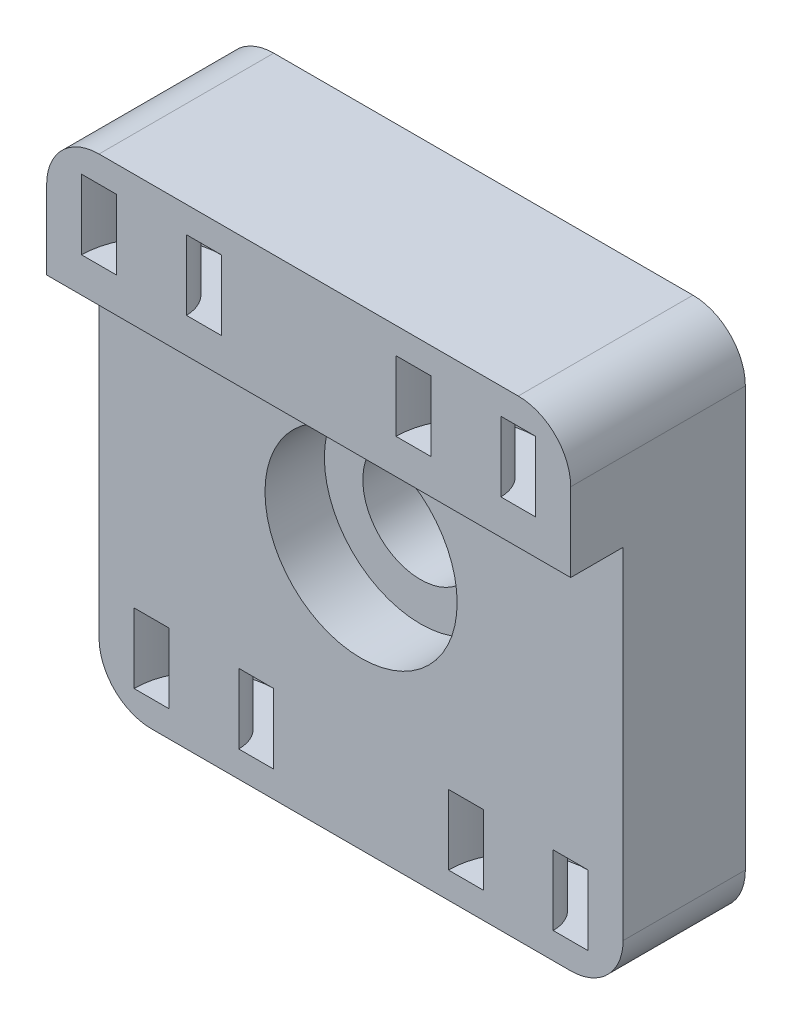
from build123d import *

# Parameters (mm, degrees)
BASE_SKETCH_W           = 30
BASE_SKETCH_H           = 30
BASE_DEPTH              = 7
HIGHER_ADAPTER_SKETCH_W = 30
HIGHER_ADAPTER_SKETCH_H = 7.5
HIGHER_ADAPTER_DEPTH    = 3
MOUNT_SCREW_D           = 6.6
MOUNT_SCREW_CBORE_D     = 11
MOUNT_SCREW_CBORE_DEPTH = 3.4
BOTTOM_TIES_SKETCH_R    = 4
BOTTOM_TIES_SKETCH_R_2  = 2
BOTTOM_TIES_DEPTH       = 4
TOP_TIES_SKETCH_R       = 4
TOP_TIES_SKETCH_R_2     = 2
TOP_TIES_DEPTH          = 4
ROUNDING_R              = 3


with BuildPart() as part:
    # Base sketch → Base (new body)
    with BuildSketch(Plane.XY):
        Rectangle(BASE_SKETCH_W, BASE_SKETCH_H)
    extrude(amount=BASE_DEPTH)

    # Higher adapter sketch → Higher adapter (add)
    with BuildSketch(Plane.XY.offset(7)):
        with Locations((0, 11.25)):
            Rectangle(HIGHER_ADAPTER_SKETCH_W, HIGHER_ADAPTER_SKETCH_H)
    extrude(amount=HIGHER_ADAPTER_DEPTH)

    # Mount screw (through all)
    with Locations(Plane.XY.offset(7)):
        with Locations((0, 0)):
            CounterBoreHole(MOUNT_SCREW_D / 2, MOUNT_SCREW_CBORE_D / 2, MOUNT_SCREW_CBORE_DEPTH)

    # Bottom ties sketch → Bottom ties (cut)
    # profile 1 of 2: a face of its own
    with BuildSketch(Plane.XZ.offset(13.5)):
        with Locations((-9, 7)):
            Circle(BOTTOM_TIES_SKETCH_R)
        with Locations((-9, 7)):
            Circle(BOTTOM_TIES_SKETCH_R_2, mode=Mode.SUBTRACT)
    # profile 2 of 2: a face of its own
    with BuildSketch(Plane.XZ.offset(13.5)):
        with Locations((9, 7)):
            Circle(BOTTOM_TIES_SKETCH_R)
        with Locations((9, 7)):
            Circle(BOTTOM_TIES_SKETCH_R_2, mode=Mode.SUBTRACT)
    extrude(amount=-BOTTOM_TIES_DEPTH, mode=Mode.SUBTRACT)

    # Top ties sketch → Top ties (cut)
    # profile 1 of 2: a face of its own
    with BuildSketch(Plane(origin=(0, 13.5, 0), x_dir=(1, 0, 0), z_dir=(0, 1, 0))):
        with Locations((-9, -10)):
            Circle(TOP_TIES_SKETCH_R)
        with Locations((-9, -10)):
            Circle(TOP_TIES_SKETCH_R_2, mode=Mode.SUBTRACT)
    # profile 2 of 2: a face of its own
    with BuildSketch(Plane(origin=(0, 13.5, 0), x_dir=(1, 0, 0), z_dir=(0, 1, 0))):
        with Locations((9, -10)):
            Circle(TOP_TIES_SKETCH_R)
        with Locations((9, -10)):
            Circle(TOP_TIES_SKETCH_R_2, mode=Mode.SUBTRACT)
    extrude(amount=-TOP_TIES_DEPTH, mode=Mode.SUBTRACT)

    # Rounding
    rounding_edges = [part.edges().sort_by_distance(p)[0] for p in [
        (15, -15, 3.5),
        (-15, -15, 3.5),
        (-15, 15, 5),
        (15, 15, 5),
    ]]
    fillet(rounding_edges, radius=ROUNDING_R)


solid = part.part
